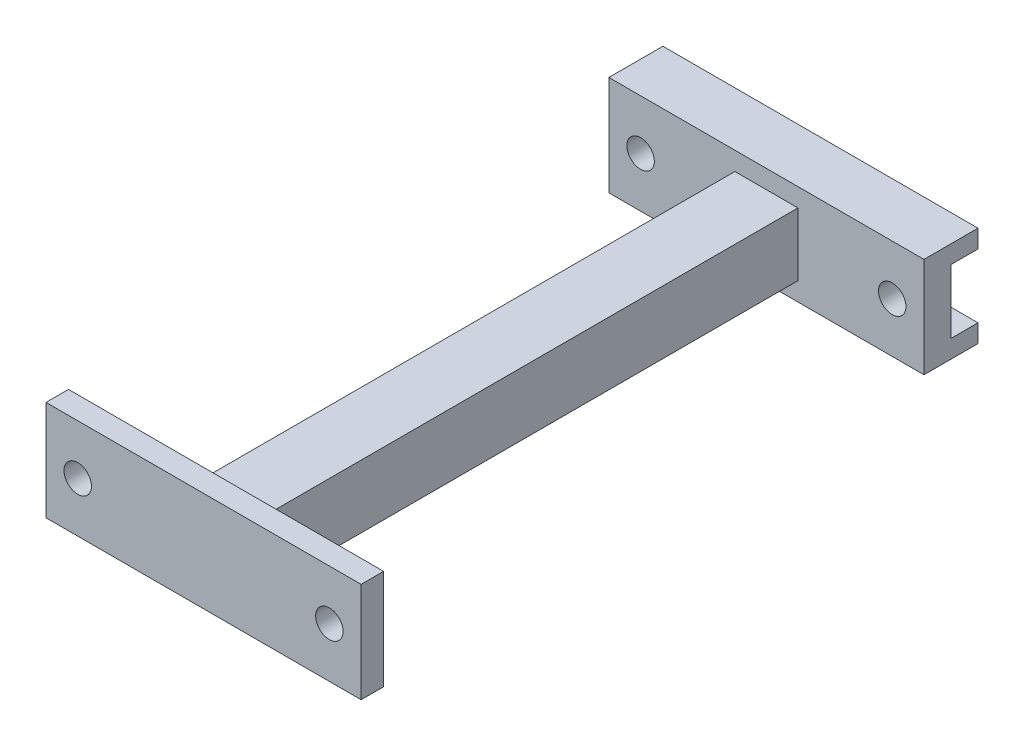
from build123d import *

# Parameters (mm, degrees)
SKETCH2_W           = 34.99
SKETCH2_H           = 7.1
SKETCH2_R           = 1.525
BOSS_EXTRUDE1_DEPTH = 3
SKETCH3_W           = 34.99
SKETCH3_H           = 2
BOSS_EXTRUDE2_DEPTH = 6
SKETCH4_W           = 7
SKETCH4_H           = 7
BOSS_EXTRUDE3_DEPTH = 60
SKETCH5_W           = 34.99
SKETCH5_H           = 11.1
SKETCH5_R           = 1.525
BOSS_EXTRUDE4_DEPTH = 2.5


with BuildPart() as part:
    # Sketch2 → Boss-Extrude1 (new body)
    with BuildSketch(Plane.XY):
        with Locations((13.97, 0)):
            Rectangle(SKETCH2_W, SKETCH2_H)
        Circle(SKETCH2_R, mode=Mode.SUBTRACT)
        with Locations((27.94, 0)):
            Circle(SKETCH2_R, mode=Mode.SUBTRACT)
    extrude(amount=BOSS_EXTRUDE1_DEPTH)

    # Sketch3 → Boss-Extrude2 (add)
    with BuildSketch(Plane.XY.offset(3)):
        with Locations((13.97, -4.55)):
            Rectangle(SKETCH3_W, SKETCH3_H)
        with Locations((13.97, 4.55)):
            Rectangle(SKETCH3_W, SKETCH3_H)
    extrude(amount=-BOSS_EXTRUDE2_DEPTH)

    # Sketch4 → Boss-Extrude3 (add)
    with BuildSketch(Plane.XY.offset(3)):
        with Locations((13.97, 0)):
            Rectangle(SKETCH4_W, SKETCH4_H)
    extrude(amount=BOSS_EXTRUDE3_DEPTH)

    # Sketch5 → Boss-Extrude4 (add)
    with BuildSketch(Plane.XY.offset(63)):
        with Locations((13.97, 0)):
            Rectangle(SKETCH5_W, SKETCH5_H)
        Circle(SKETCH5_R, mode=Mode.SUBTRACT)
        with Locations((27.94, 0)):
            Circle(SKETCH5_R, mode=Mode.SUBTRACT)
    extrude(amount=BOSS_EXTRUDE4_DEPTH)


solid = part.part
